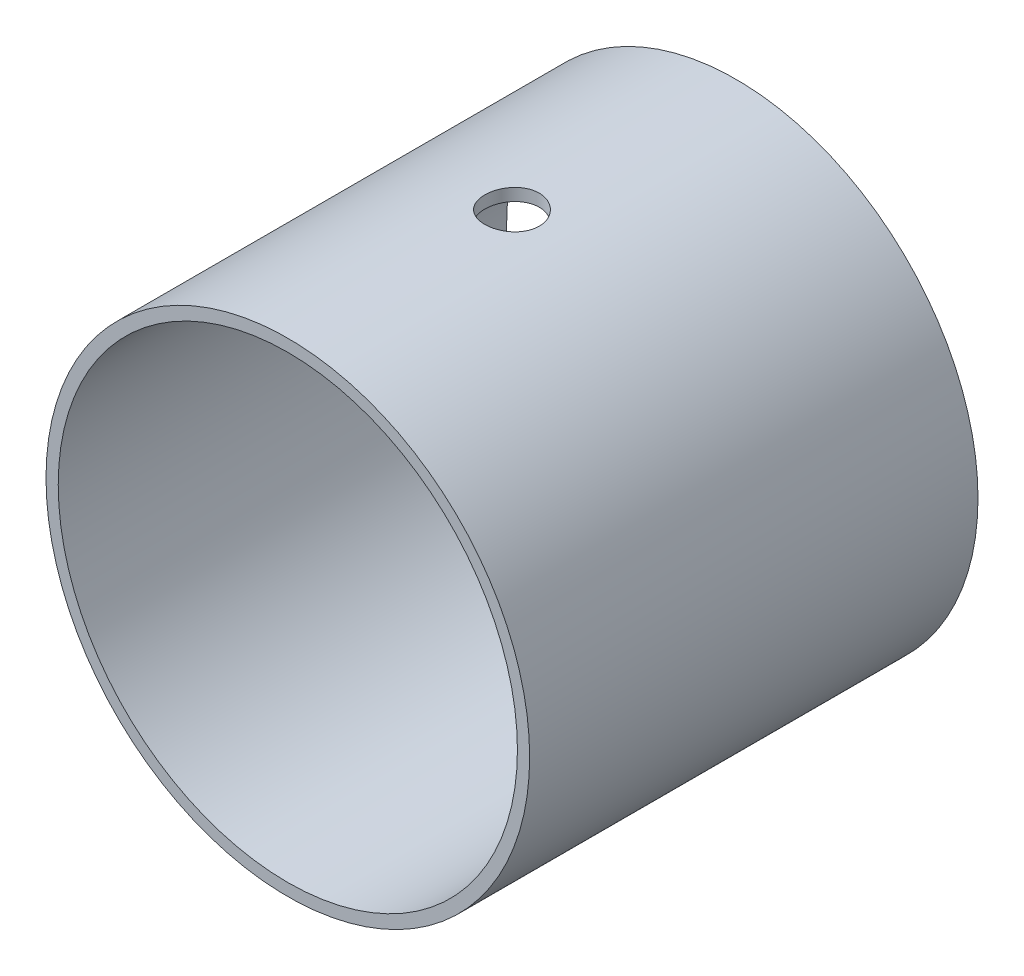
from build123d import *

# Parameters (mm, degrees)
CROQUIS1_R              = 17.8
CROQUIS1_R_2            = 16.9
SALIENTE_EXTRUIR1_DEPTH = 16.5
CROQUIS2_R              = 2
CORTAR_EXTRUIR1_DEPTH   = 26


with BuildPart() as part:
    # Croquis1 → Saliente-Extruir1 (new, symmetric)
    with BuildSketch(Plane.XY):
        Circle(CROQUIS1_R)
        Circle(CROQUIS1_R_2, mode=Mode.SUBTRACT)
    extrude(amount=SALIENTE_EXTRUIR1_DEPTH, both=True)

    # Croquis2 → Cortar-Extruir1 (cut)
    with BuildSketch(Plane(origin=(0, 17.8, 0), x_dir=(-1, 0, 0), z_dir=(0, 1, 0))):
        with Locations(Location((0, 0, 0), (0, 0, 90))):
            Circle(CROQUIS2_R)
    extrude(amount=-CORTAR_EXTRUIR1_DEPTH, mode=Mode.SUBTRACT)


solid = part.part
